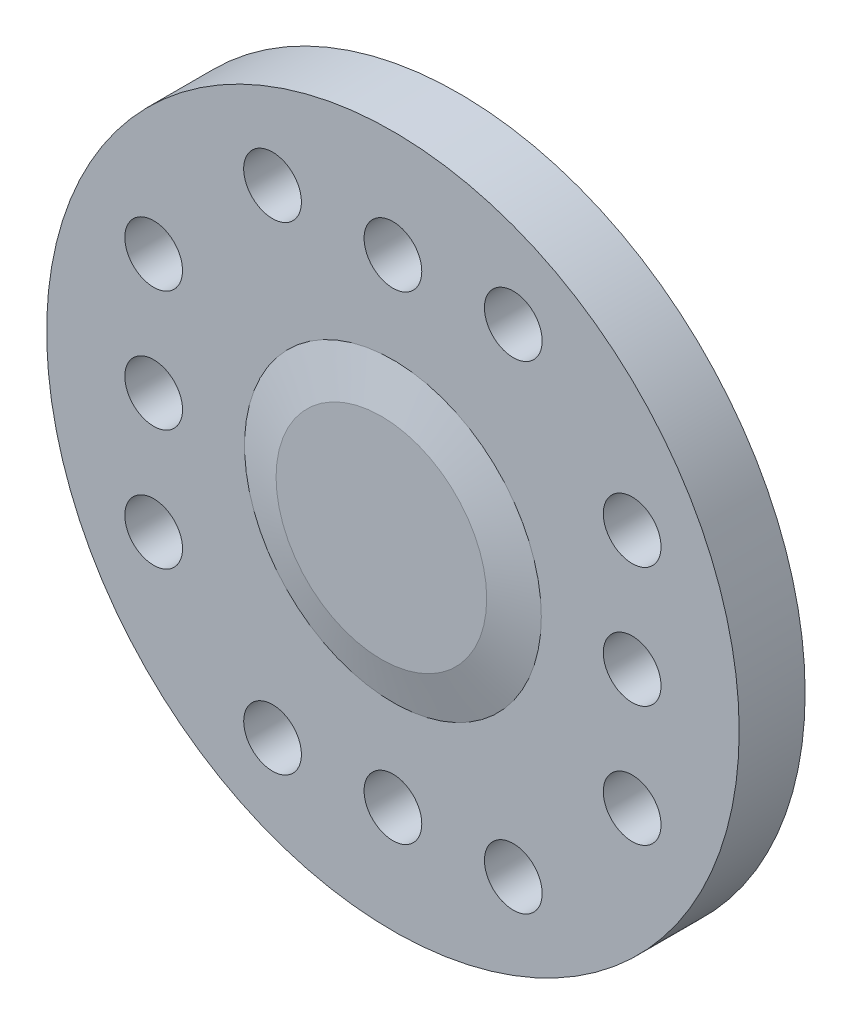
from build123d import *

# Parameters (mm, degrees)
ESQUISSE1_R             = 10.5
ESQUISSE1_R_2           = 0.875
BOSS_EXTRU_1_DEPTH      = 2
ESQUISSE2_R             = 4.5
BOSS_EXTRU_2_DEPTH      = 0.35
BOSS_EXTRU_2_TAPER      = 75
ESQUISSE3_R             = 4
BOSS_EXTRU_3_DEPTH      = 3.4
ESQUISSE4_R             = 2.85
ENL_V_MAT_EXTRU_1_DEPTH = 3.8


with BuildPart() as part:
    # Esquisse1 → Boss.-Extru.1 (new body)
    with BuildSketch(Plane.XY):
        Circle(ESQUISSE1_R)
        with Locations((7.2545, 3.65)):
            Circle(ESQUISSE1_R_2, mode=Mode.SUBTRACT)
        with Locations((7.2545, 0)):
            Circle(ESQUISSE1_R_2, mode=Mode.SUBTRACT)
        with Locations(Location((7.2545, -3.65, 0), (0, 0, 180))):
            Circle(ESQUISSE1_R_2, mode=Mode.SUBTRACT)
        with Locations((3.65, -7.2545)):
            Circle(ESQUISSE1_R_2, mode=Mode.SUBTRACT)
        with Locations((0, -7.2545)):
            Circle(ESQUISSE1_R_2, mode=Mode.SUBTRACT)
        with Locations(Location((-3.65, -7.2545, 0), (0, 0, 180))):
            Circle(ESQUISSE1_R_2, mode=Mode.SUBTRACT)
        with Locations((-7.2545, -3.65)):
            Circle(ESQUISSE1_R_2, mode=Mode.SUBTRACT)
        with Locations((-7.2545, 0)):
            Circle(ESQUISSE1_R_2, mode=Mode.SUBTRACT)
        with Locations(Location((-7.2545, 3.65, 0), (0, 0, 180))):
            Circle(ESQUISSE1_R_2, mode=Mode.SUBTRACT)
        with Locations((-3.65, 7.2545)):
            Circle(ESQUISSE1_R_2, mode=Mode.SUBTRACT)
        with Locations((0, 7.2545)):
            Circle(ESQUISSE1_R_2, mode=Mode.SUBTRACT)
        with Locations(Location((3.65, 7.2545, 0), (0, 0, 180))):
            Circle(ESQUISSE1_R_2, mode=Mode.SUBTRACT)
    extrude(amount=BOSS_EXTRU_1_DEPTH)

    # Esquisse2 → Boss.-Extru.2 (add)
    with BuildSketch(Plane.XY.offset(2)):
        Circle(ESQUISSE2_R)
    extrude(amount=BOSS_EXTRU_2_DEPTH, taper=BOSS_EXTRU_2_TAPER)

    # Esquisse3 → Boss.-Extru.3 (add)
    with BuildSketch(Plane(origin=(0, 0, 0), x_dir=(-1, 0, 0), z_dir=(0, 0, -1))):
        with Locations(Location((0, 0, 0), (0, 0, 180))):
            Circle(ESQUISSE3_R)
    extrude(amount=BOSS_EXTRU_3_DEPTH)

    # Esquisse4 → Enlèv. mat.-Extru.1 (cut)
    with BuildSketch(Plane(origin=(0, 0, -3.4), x_dir=(-1, 0, 0), z_dir=(0, 0, -1))):
        Circle(ESQUISSE4_R)
    extrude(amount=-ENL_V_MAT_EXTRU_1_DEPTH, mode=Mode.SUBTRACT)


solid = part.part
